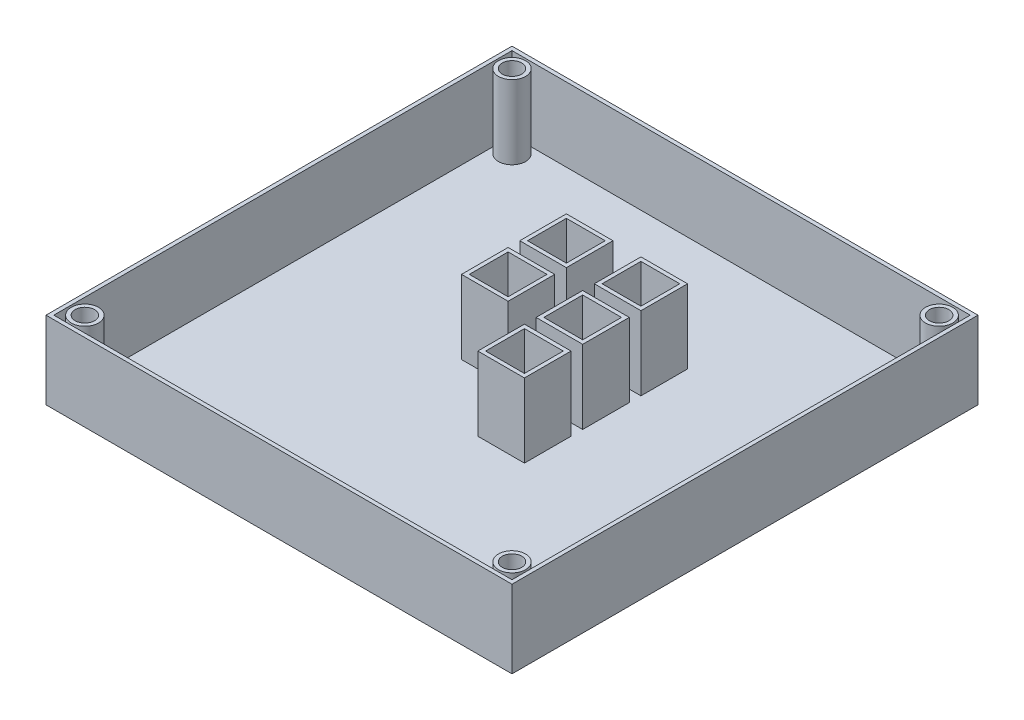
from build123d import *

# Parameters (mm, degrees)
SKETCH1_W           = 152.4
SKETCH1_H           = 152.4
BOSS_EXTRUDE1_DEPTH = 25.4
SKETCH3_R           = 3.175
CUT_EXTRUDE1_DEPTH  = 130.830173774
SKETCH4_W           = 12.7
SKETCH4_H           = 12.7
CUT_EXTRUDE2_DEPTH  = 130.830173774
SHELL1_T            = -1.27


with BuildPart() as part:
    # Sketch1 → Boss-Extrude1 (new body)
    with BuildSketch(Plane(origin=(0, 0, 0), x_dir=(1, 0, 0), z_dir=(0, 1, 0))):
        with Locations((1.284269663, 24.829213483)):
            Rectangle(SKETCH1_W, SKETCH1_H)
    extrude(amount=BOSS_EXTRUDE1_DEPTH)

    # Sketch3 → Cut-Extrude1 (cut, through all)
    with BuildSketch(Plane(origin=(0, 25.4, 0), x_dir=(1, 0, 0), z_dir=(0, 1, 0))):
        with Locations(Location((-68.565730337, 94.679213483, 0), (0, 0, 270))):
            Circle(SKETCH3_R)
        with Locations(Location((71.134269663, 94.679213483, 0), (0, 0, 270))):
            Circle(SKETCH3_R)
        with Locations(Location((-68.565730337, -45.020786517, 0), (0, 0, 270))):
            Circle(SKETCH3_R)
        with Locations(Location((71.134269663, -45.020786517, 0), (0, 0, 270))):
            Circle(SKETCH3_R)
    extrude(amount=-CUT_EXTRUDE1_DEPTH, mode=Mode.SUBTRACT)

    # Sketch4 → Cut-Extrude2 (cut, through all)
    with BuildSketch(Plane(origin=(0, 25.4, 0), x_dir=(1, 0, 0), z_dir=(0, 1, 0))):
        with Locations((-10.907730337, 54.801213483)):
            Rectangle(SKETCH4_W, SKETCH4_H)
        with Locations((13.476269663, 54.801213483)):
            Rectangle(SKETCH4_W, SKETCH4_H)
        with Locations((-10.907730337, 35.751213483)):
            Rectangle(SKETCH4_W, SKETCH4_H)
        with Locations((13.476269663, 35.751213483)):
            Rectangle(SKETCH4_W, SKETCH4_H)
        with Locations((13.476269663, 16.701213483)):
            Rectangle(SKETCH4_W, SKETCH4_H)
    extrude(amount=-CUT_EXTRUDE2_DEPTH, mode=Mode.SUBTRACT)

    # Shell1
    shell1_openings = [part.faces().sort_by_distance(p)[0] for p in [
        (-10.907730337, 25.4, -35.751213483),
    ]]
    offset(amount=SHELL1_T, openings=shell1_openings, kind=Kind.INTERSECTION)


solid = part.part
